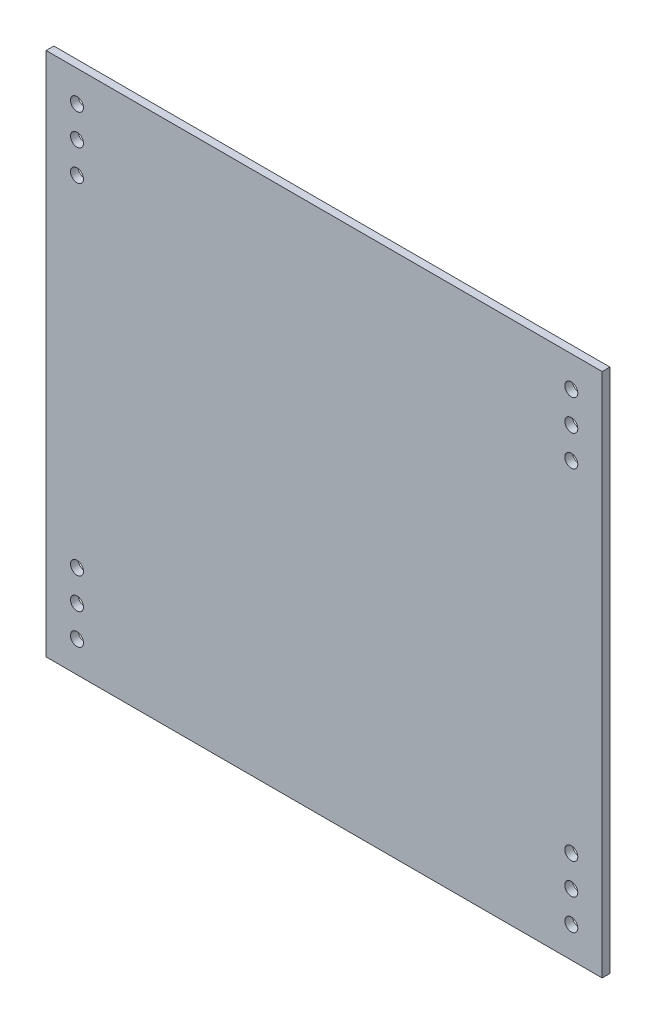
from build123d import *

# Parameters (mm, degrees)
SKETCH1_W           = 228.6
SKETCH1_H           = 215.9
BOSS_EXTRUDE1_DEPTH = 3.175
SKETCH2_R           = 2.667
CUT_EXTRUDE1_DEPTH  = 3.175


with BuildPart() as part:
    # Sketch1 → Boss-Extrude1 (new body)
    with BuildSketch(Plane.XY):
        Rectangle(SKETCH1_W, SKETCH1_H)
    extrude(amount=BOSS_EXTRUDE1_DEPTH)

    # Sketch2 → Cut-Extrude1 (cut)
    with BuildSketch(Plane.XY.offset(3.175)):
        with Locations((-101.6, -69.85)):
            Circle(SKETCH2_R)
        with Locations((-101.6, -82.55)):
            Circle(SKETCH2_R)
        with Locations((-101.6, -95.25)):
            Circle(SKETCH2_R)
        with Locations(Location((-101.6, 95.25, 0), (0, 0, 180))):
            Circle(SKETCH2_R)
        with Locations(Location((-101.6, 82.55, 0), (0, 0, 180))):
            Circle(SKETCH2_R)
        with Locations(Location((-101.6, 69.85, 0), (0, 0, 180))):
            Circle(SKETCH2_R)
        with Locations((101.6, 95.25)):
            Circle(SKETCH2_R)
        with Locations((101.6, 82.55)):
            Circle(SKETCH2_R)
        with Locations((101.6, 69.85)):
            Circle(SKETCH2_R)
        with Locations(Location((101.6, -95.25, 0), (0, 0, 180))):
            Circle(SKETCH2_R)
        with Locations(Location((101.6, -82.55, 0), (0, 0, 180))):
            Circle(SKETCH2_R)
        with Locations(Location((101.6, -69.85, 0), (0, 0, 180))):
            Circle(SKETCH2_R)
    extrude(amount=-CUT_EXTRUDE1_DEPTH, mode=Mode.SUBTRACT)


solid = part.part
